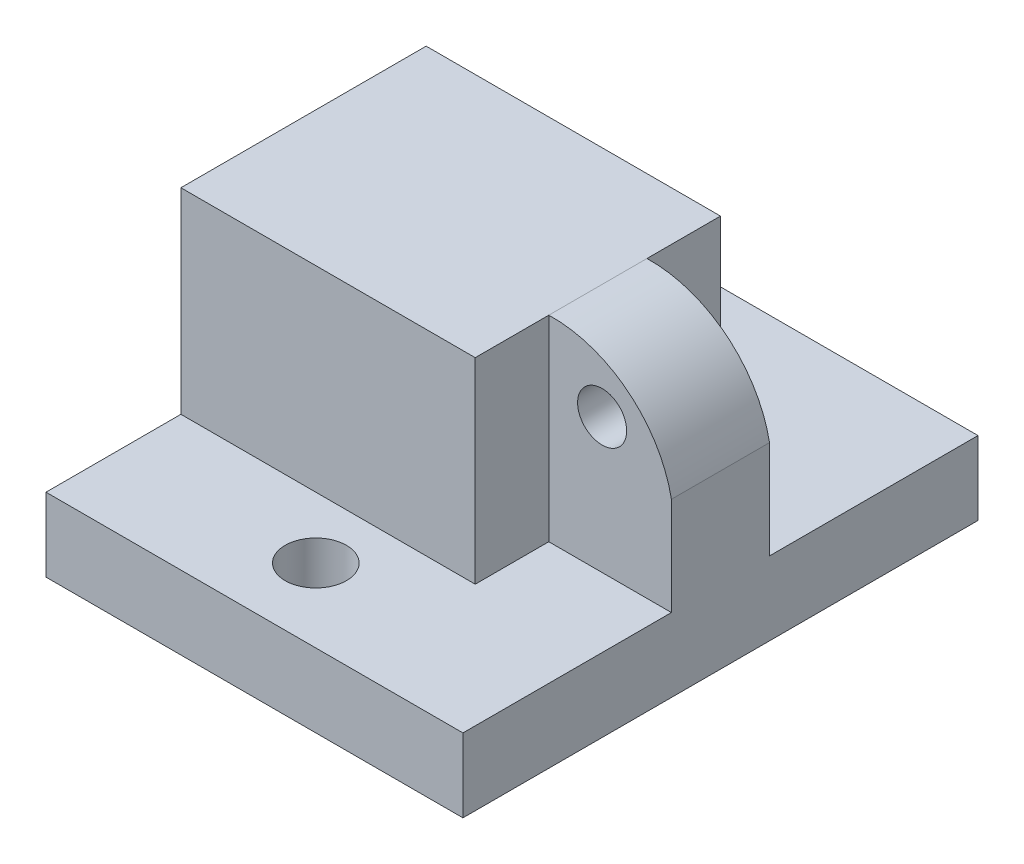
from build123d import *

# Parameters (mm, degrees)
SKETCH2_W           = 17
SKETCH2_H           = 21
BOSS_EXTRUDE1_DEPTH = 3
SKETCH4_R           = 1.25
CUT_EXTRUDE1_DEPTH  = 6
SKETCH5_R           = 1.25
CUT_EXTRUDE2_DEPTH  = 6
SKETCH6_W           = 12
SKETCH6_H           = 10
BOSS_EXTRUDE3_DEPTH = 8
SKETCH7_W           = 5
SKETCH7_H           = 4
BOSS_EXTRUDE4_DEPTH = 4
BOSS_EXTRUDE5_DEPTH = 4
SKETCH9_R           = 1
CUT_EXTRUDE3_DEPTH  = 6


with BuildPart() as part:
    # Sketch2 → Boss-Extrude1 (new body)
    with BuildSketch(Plane(origin=(0, 0, 0), x_dir=(1, 0, 0), z_dir=(0, 1, 0))):
        with Locations((8.5, 10.5)):
            Rectangle(SKETCH2_W, SKETCH2_H)
    extrude(amount=BOSS_EXTRUDE1_DEPTH)

    # Sketch4 → Cut-Extrude1 (cut)
    with BuildSketch(Plane(origin=(0, 3, 0), x_dir=(1, 0, 0), z_dir=(0, 1, 0))):
        with Locations(Location((8, 18, 0), (0, 0, 270))):
            Circle(SKETCH4_R)
    extrude(amount=-CUT_EXTRUDE1_DEPTH, mode=Mode.SUBTRACT)

    # Sketch5 → Cut-Extrude2 (cut)
    with BuildSketch(Plane(origin=(0, 3, 0), x_dir=(1, 0, 0), z_dir=(0, 1, 0))):
        with Locations(Location((8, 3, 0), (0, 0, 270))):
            Circle(SKETCH5_R)
    extrude(amount=-CUT_EXTRUDE2_DEPTH, mode=Mode.SUBTRACT)

    # Sketch6 → Boss-Extrude3 (add)
    with BuildSketch(Plane(origin=(0, 3, 0), x_dir=(1, 0, 0), z_dir=(0, 1, 0))):
        with Locations((6, 10.5)):
            Rectangle(SKETCH6_W, SKETCH6_H)
    extrude(amount=BOSS_EXTRUDE3_DEPTH)

    # Sketch7 → Boss-Extrude4 (add)
    with BuildSketch(Plane(origin=(0, 3, 0), x_dir=(1, 0, 0), z_dir=(0, 1, 0))):
        with Locations((14.5, 10.5)):
            Rectangle(SKETCH7_W, SKETCH7_H)
    extrude(amount=BOSS_EXTRUDE4_DEPTH)

    # Sketch8 → Boss-Extrude5 (add)
    with BuildSketch(Plane(origin=(0, 0, -12.5), x_dir=(-1, 0, 0), z_dir=(0, 0, -1))):
        with BuildLine():
            Line((-17, 7), (-12, 7))
            Line((-12, 7), (-12, 11))
            ThreePointArc((-12, 11), (-15.234221224, 9.91777653), (-17, 7))
        make_face()
    extrude(amount=-BOSS_EXTRUDE5_DEPTH)

    # Sketch9 → Cut-Extrude3 (cut)
    with BuildSketch(Plane.XY.offset(-8.5)):
        with Locations((14.174425002, 8.5)):
            Circle(SKETCH9_R)
    extrude(amount=-CUT_EXTRUDE3_DEPTH, mode=Mode.SUBTRACT)


solid = part.part
